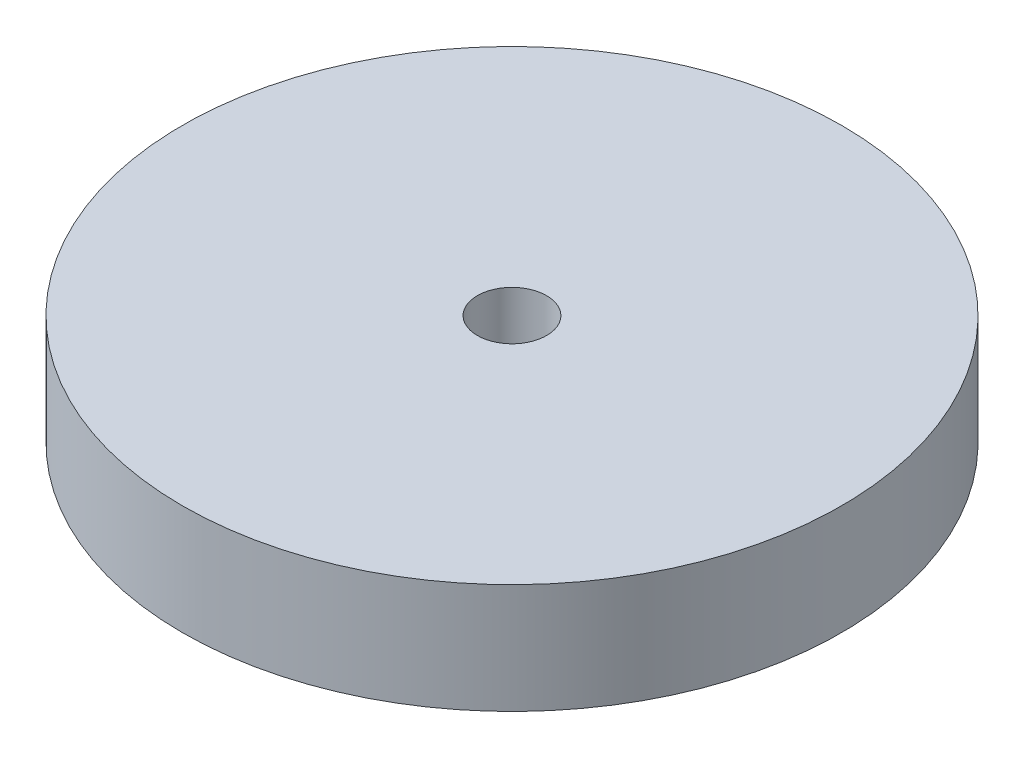
from build123d import *

# Parameters (mm, degrees)
ESQUISSE1_R             = 30
BOSS_EXTRU_1_DEPTH      = 10
ESQUISSE2_R             = 3.15
ENL_V_MAT_EXTRU_1_DEPTH = 44.588989435


with BuildPart() as part:
    # Esquisse1 → Boss.-Extru.1 (new body)
    with BuildSketch(Plane(origin=(0, 0, 0), x_dir=(1, 0, 0), z_dir=(0, 1, 0))):
        with Locations(Location((0, 0, 0), (0, 0, 270))):
            Circle(ESQUISSE1_R)
    extrude(amount=BOSS_EXTRU_1_DEPTH)

    # Esquisse2 → Enlèv. mat.-Extru.1 (cut, through all)
    with BuildSketch(Plane(origin=(0, 10, 0), x_dir=(1, 0, 0), z_dir=(0, 1, 0))):
        with Locations(Location((0, 0, 0), (0, 0, 270))):
            Circle(ESQUISSE2_R)
    extrude(amount=-ENL_V_MAT_EXTRU_1_DEPTH, mode=Mode.SUBTRACT)


solid = part.part
